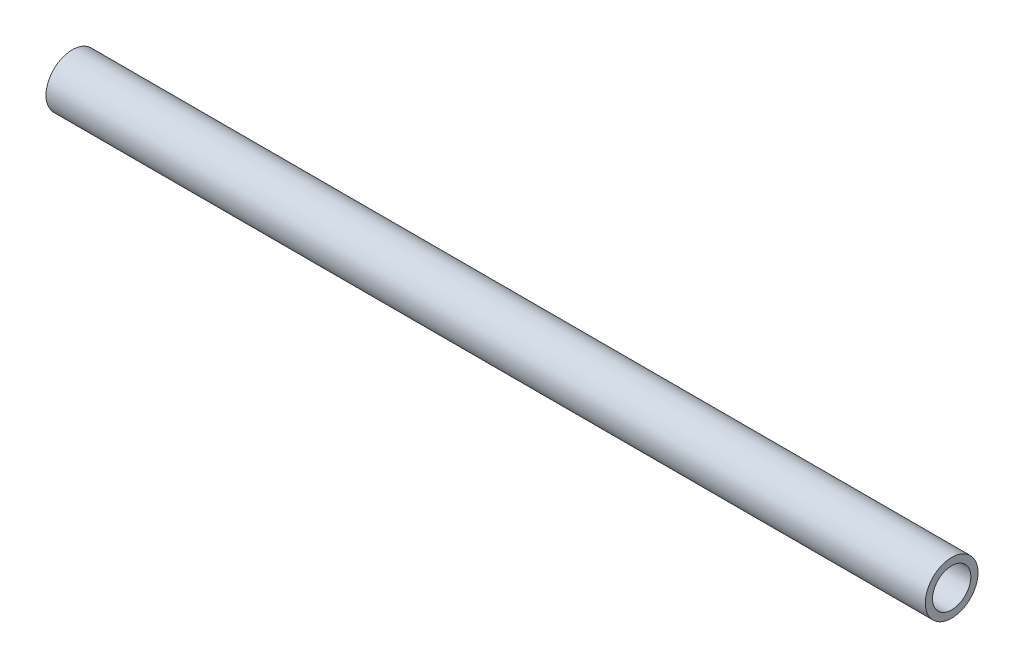
from build123d import *

# Parameters (mm, degrees)
SKETCH1_R           = 13.15
SKETCH1_R_2         = 9.55
BOSS_EXTRUDE1_DEPTH = 438.4


with BuildPart() as part:
    # Sketch1 → Boss-Extrude1 (new body)
    with BuildSketch(Plane(origin=(0, 0, 0), x_dir=(0, 0, -1), z_dir=(1, 0, 0))):
        with Locations(Location((0, 0, 0), (0, 0, 180))):
            Circle(SKETCH1_R)
        with Locations(Location((0, 0, 0), (0, 0, 180))):
            Circle(SKETCH1_R_2, mode=Mode.SUBTRACT)
    extrude(amount=BOSS_EXTRUDE1_DEPTH)


solid = part.part
